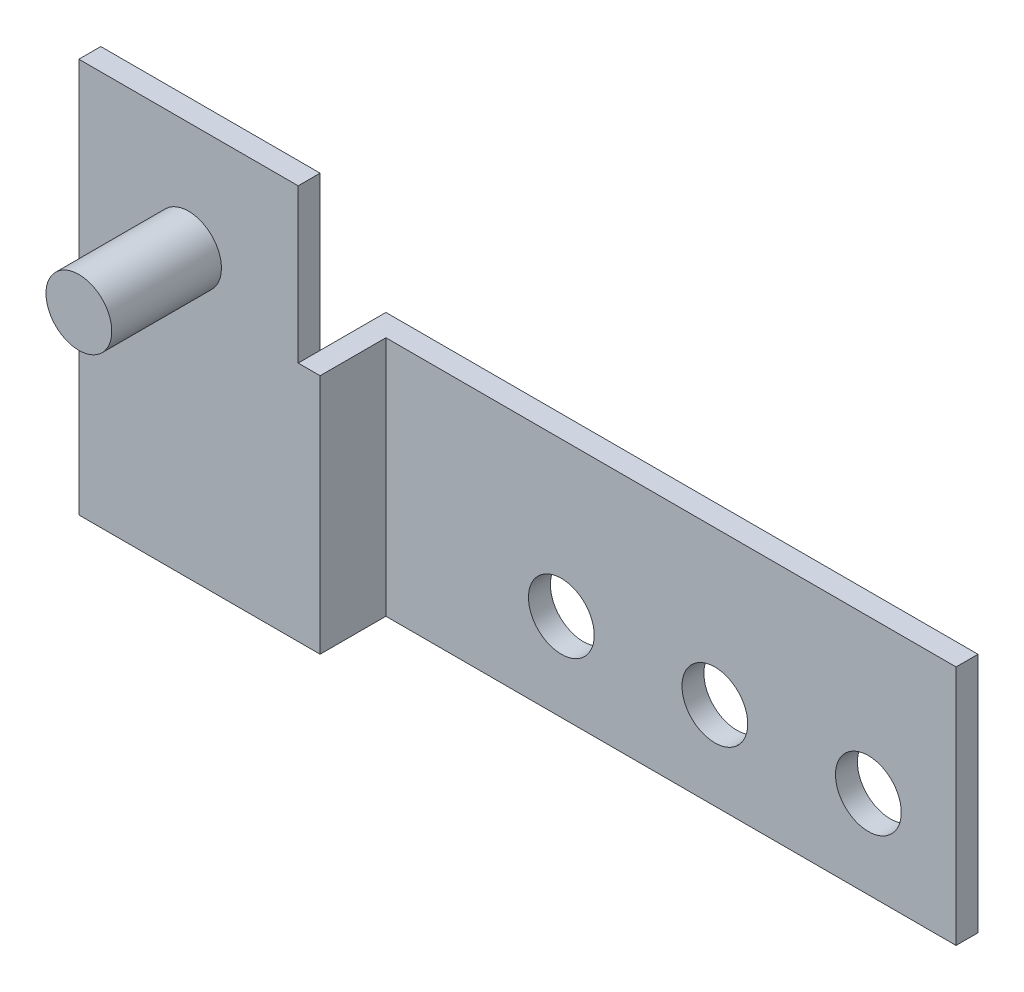
from build123d import *

# Parameters (mm, degrees)
SKETCH_1_W            = 37
SKETCH_1_H            = 18
EXTRUDE_1_DEPTH       = 1
SKETCH_2_W            = 27
SKETCH_2_H            = 7
CUT_EXTRUDE_1_DEPTH   = 33.465366161
SKETCH_3_W            = 27
SKETCH_3_H            = 11
EXTRUDE_2_DEPTH       = 3
SKETCH_4_W            = 26
SKETCH_4_H            = 3
CUT_EXTRUDE_2_DEPTH   = 33.695565449
SKETCH_5_W            = 1.5
SKETCH_5_H            = 5
HOLE_WIZARD_3_0_3_1_D = 3


with BuildPart() as part:
    # Эскиз1 → Бобышка-Вытянуть1 (new body)
    with BuildSketch(Plane(origin=(0, 0, 3), x_dir=(-1, 0, 0), z_dir=(0, 0, -1))):
        with Locations((-8.5, 9)):
            Rectangle(SKETCH_1_W, SKETCH_1_H)
    extrude(amount=-EXTRUDE_1_DEPTH)

    # Эскиз2 → Вырез-Вытянуть1 (cut, through all)
    with BuildSketch(Plane.XY.offset(4)):
        with Locations((13.5, 14.5)):
            Rectangle(SKETCH_2_W, SKETCH_2_H)
    extrude(amount=-CUT_EXTRUDE_1_DEPTH, mode=Mode.SUBTRACT)

    # Эскиз3 → Бобышка-Вытянуть2 (add)
    with BuildSketch(Plane(origin=(0, 0, 3), x_dir=(-1, 0, 0), z_dir=(0, 0, -1))):
        with Locations((-13.5, 5.5)):
            Rectangle(SKETCH_3_W, SKETCH_3_H)
    extrude(amount=EXTRUDE_2_DEPTH)

    # Эскиз4 → Вырез-Вытянуть2 (cut, through all)
    with BuildSketch(Plane.XZ):
        with Locations((14, 2.5)):
            Rectangle(SKETCH_4_W, SKETCH_4_H)
    extrude(amount=-CUT_EXTRUDE_2_DEPTH, mode=Mode.SUBTRACT)

    # Эскиз5 → Повернуть1 (revolve)
    with BuildSketch(Plane.XZ.offset(-13), mode=Mode.PRIVATE) as revolve_1_sk:
        with Locations((-4.25, 6.5)):
            Rectangle(SKETCH_5_W, SKETCH_5_H)
    revolve(revolve_1_sk.sketch.rotate(Axis((-5, 13, 9), (0, 0, -1)), 270), axis=Axis((-5, 13, 9), (0, 0, -1)))

    # Диаметр отверстия Ø3.0 (3)1 (through all)
    with Locations(Plane.XY.offset(1)):
        with Locations((23, 4), (16, 4), (9, 4)):
            Hole(HOLE_WIZARD_3_0_3_1_D / 2)


solid = part.part
